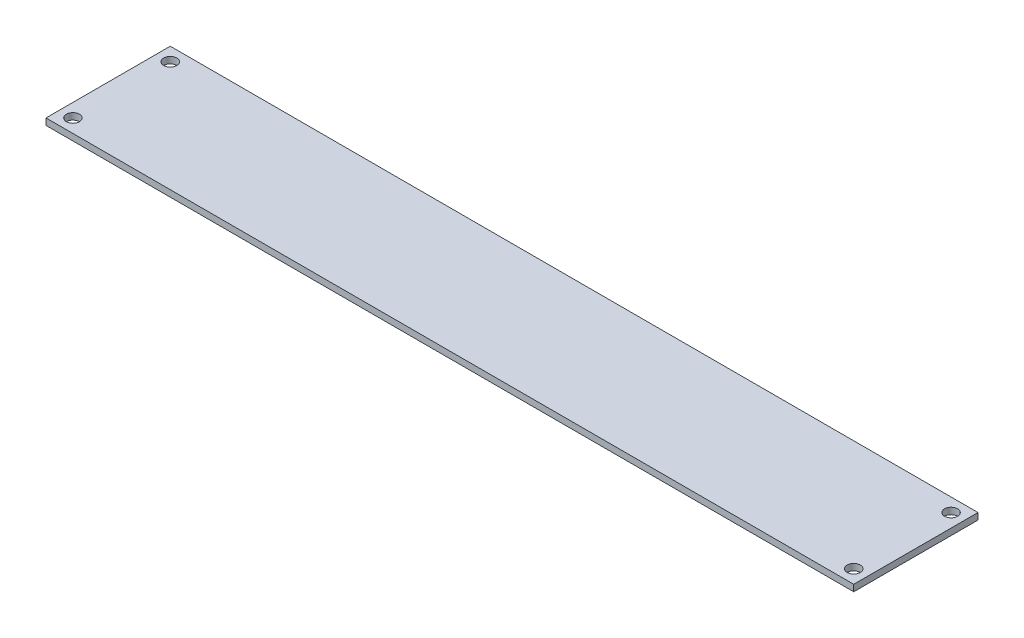
from build123d import *

# Parameters (mm, degrees)
SKETCH1_W           = 198.12
SKETCH1_H           = 30.48
SKETCH1_R           = 1.6
BOSS_EXTRUDE1_DEPTH = 1.6


with BuildPart() as part:
    # Sketch1 → Boss-Extrude1 (new body)
    with BuildSketch(Plane(origin=(0, 0, 0), x_dir=(1, 0, 0), z_dir=(0, 1, 0))):
        Rectangle(SKETCH1_W, SKETCH1_H)
        with Locations(Location((-95.758518439, 11.938518439, 0), (0, 0, 270))):
            Circle(SKETCH1_R, mode=Mode.SUBTRACT)
        with Locations(Location((-95.758518439, -11.938518439, 0), (0, 0, 90))):
            Circle(SKETCH1_R, mode=Mode.SUBTRACT)
        with Locations(Location((95.758518439, -11.938518439, 0), (0, 0, 270))):
            Circle(SKETCH1_R, mode=Mode.SUBTRACT)
        with Locations(Location((95.758518439, 11.938518439, 0), (0, 0, 90))):
            Circle(SKETCH1_R, mode=Mode.SUBTRACT)
    extrude(amount=BOSS_EXTRUDE1_DEPTH)


solid = part.part
